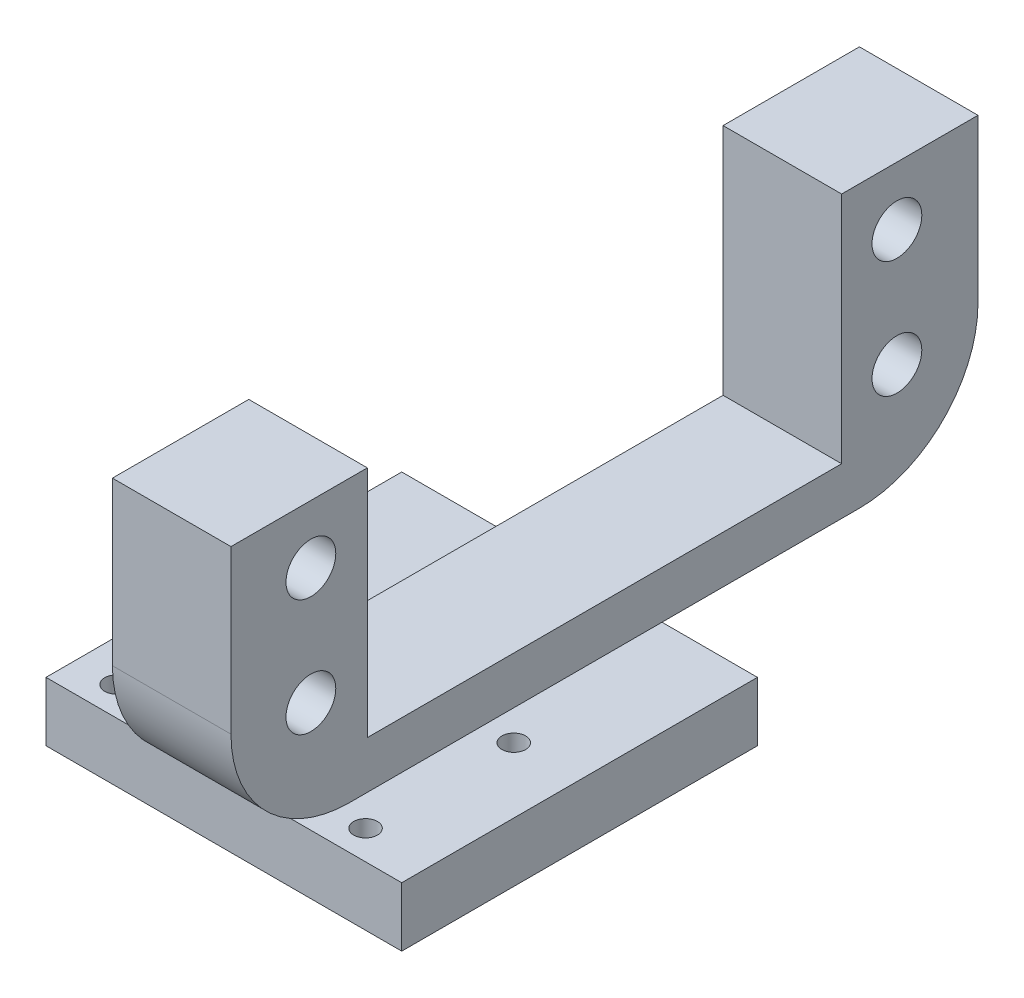
from build123d import *

# Parameters (mm, degrees)
BOSS_EXTRUDE1_DEPTH = 10
SKETCH3_R           = 2.1
CUT_EXTRUDE2_DEPTH  = 10
FILLET1_R           = 10
SKETCH4_W           = 30
SKETCH4_H           = 30
BOSS_EXTRUDE2_DEPTH = 5
SKETCH6_R           = 1
CUT_EXTRUDE3_DEPTH  = 5


with BuildPart() as part:
    # Sketch2 → Boss-Extrude1 (new body)
    with BuildSketch(Plane(origin=(0, 0, 0), x_dir=(0, 0, -1), z_dir=(1, 0, 0))):
        Polygon((0, 0), (63, 0), (63, 23.7), (51.5, 23.7), (51.5, 4), (11.5, 4), (11.5, 23.7), (0, 23.7), align=None)
    extrude(amount=BOSS_EXTRUDE1_DEPTH)

    # Sketch3 → Cut-Extrude2 (cut)
    with BuildSketch(Plane(origin=(10, 0, 0), x_dir=(0, 0, -1), z_dir=(1, 0, 0))):
        with Locations((6.738854382, 18.775)):
            Circle(SKETCH3_R)
        with Locations((56.161145618, 18.775)):
            Circle(SKETCH3_R)
        with Locations((56.161145618, 8.925)):
            Circle(SKETCH3_R)
        with Locations((6.738854382, 8.925)):
            Circle(SKETCH3_R)
    extrude(amount=-CUT_EXTRUDE2_DEPTH, mode=Mode.SUBTRACT)

    # Fillet1
    fillet1_edges = [part.edges().sort_by_distance(p)[0] for p in [
        (5, 0, -63),
        (5, 0, 0),
    ]]
    fillet(fillet1_edges, radius=FILLET1_R)

    # Sketch4 → Boss-Extrude2 (add)
    with BuildSketch(Plane.XZ):
        with Locations((3.05, -21.35)):
            Rectangle(SKETCH4_W, SKETCH4_H)
    extrude(amount=BOSS_EXTRUDE2_DEPTH)

    # Sketch6 → Cut-Extrude3 (cut)
    with BuildSketch(Plane.XZ.offset(5)):
        with Locations(Location((-8.45, -8.8, 0), (0, 0, 270))):
            Circle(SKETCH6_R)
        with Locations(Location((12.55, -8.8, 0), (0, 0, 270))):
            Circle(SKETCH6_R)
        with Locations(Location((12.55, -21.3, 0), (0, 0, 270))):
            Circle(SKETCH6_R)
        with Locations(Location((-8.45, -21.3, 0), (0, 0, 270))):
            Circle(SKETCH6_R)
    extrude(amount=-CUT_EXTRUDE3_DEPTH, mode=Mode.SUBTRACT)


solid = part.part
